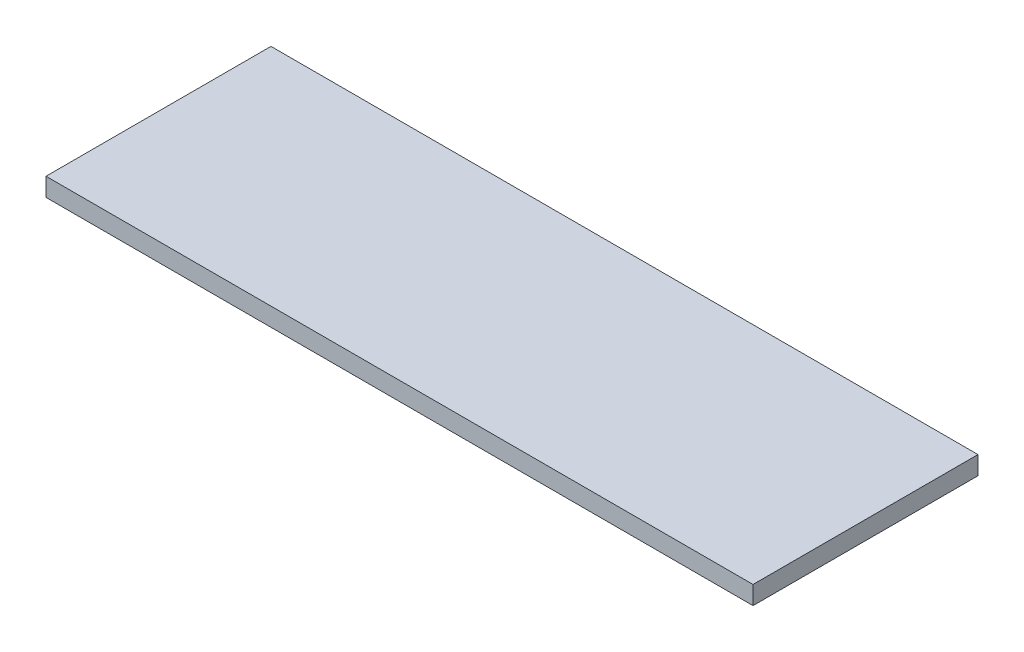
from build123d import *

# Parameters (mm, degrees)
SKETCH1_W           = 77
SKETCH1_H           = 24.5
BOSS_EXTRUDE1_DEPTH = 2


with BuildPart() as part:
    # Sketch1 → Boss-Extrude1 (new body)
    with BuildSketch(Plane(origin=(0, 0, 0), x_dir=(1, 0, 0), z_dir=(0, 1, 0))):
        Rectangle(SKETCH1_W, SKETCH1_H)
    extrude(amount=BOSS_EXTRUDE1_DEPTH)


solid = part.part
